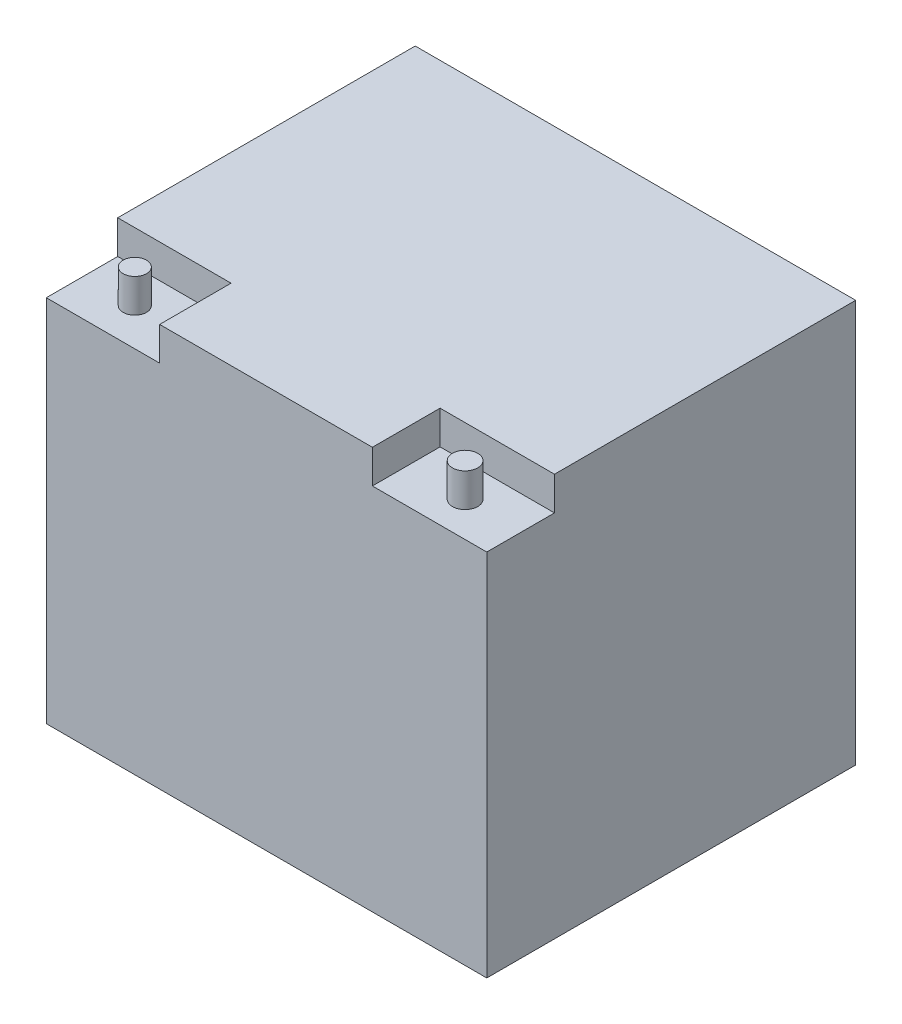
from build123d import *

# Parameters (mm, degrees)
SKETCH_2_W          = 197
SKETCH_2_H          = 165
EXTRUDE_1_DEPTH     = 180
SKETCH_3_W          = 50.684983536
SKETCH_3_H          = 31.949298514
CUT_EXTRUDE_2_DEPTH = 15
SKETCH_4_W          = 51.160754844
SKETCH_4_H          = 30.284098936
CUT_EXTRUDE_3_DEPTH = 15
SKETCH_5_R          = 5.238888092
EXTRUDE_2_DEPTH     = 15
SKETCH_6_R          = 5.653498574
EXTRUDE_3_DEPTH     = 15


with BuildPart() as part:
    # 草图2 → 凸台-拉伸1 (new body)
    with BuildSketch(Plane(origin=(0, 0, 0), x_dir=(1, 0, 0), z_dir=(0, 1, 0))):
        Rectangle(SKETCH_2_W, SKETCH_2_H)
    extrude(amount=EXTRUDE_1_DEPTH)

    # 草图3 → 切除-拉伸2 (cut)
    with BuildSketch(Plane(origin=(0, 180, 0), x_dir=(1, 0, 0), z_dir=(0, 1, 0))):
        with Locations((-73.157508232, -66.525350743)):
            Rectangle(SKETCH_3_W, SKETCH_3_H)
    extrude(amount=-CUT_EXTRUDE_2_DEPTH, mode=Mode.SUBTRACT)

    # 草图4 → 切除-拉伸3 (cut)
    with BuildSketch(Plane(origin=(0, 180, 0), x_dir=(1, 0, 0), z_dir=(0, 1, 0))):
        with Locations((72.919622578, -67.357950532)):
            Rectangle(SKETCH_4_W, SKETCH_4_H)
    extrude(amount=-CUT_EXTRUDE_3_DEPTH, mode=Mode.SUBTRACT)

    # 草图5 → 凸台-拉伸2 (add)
    with BuildSketch(Plane(origin=(0, 165, 0), x_dir=(1, 0, 0), z_dir=(0, 1, 0))):
        with Locations(Location((-75.647637988, -65.775383345, 0), (0, 0, 90))):
            Circle(SKETCH_5_R)
    extrude(amount=EXTRUDE_2_DEPTH)

    # 草图6 → 凸台-拉伸3 (add)
    with BuildSketch(Plane(origin=(0, 165, 0), x_dir=(1, 0, 0), z_dir=(0, 1, 0))):
        with Locations(Location((73.228131145, -66.927099699, 0), (0, 0, 270))):
            Circle(SKETCH_6_R)
    extrude(amount=EXTRUDE_3_DEPTH)


solid = part.part
